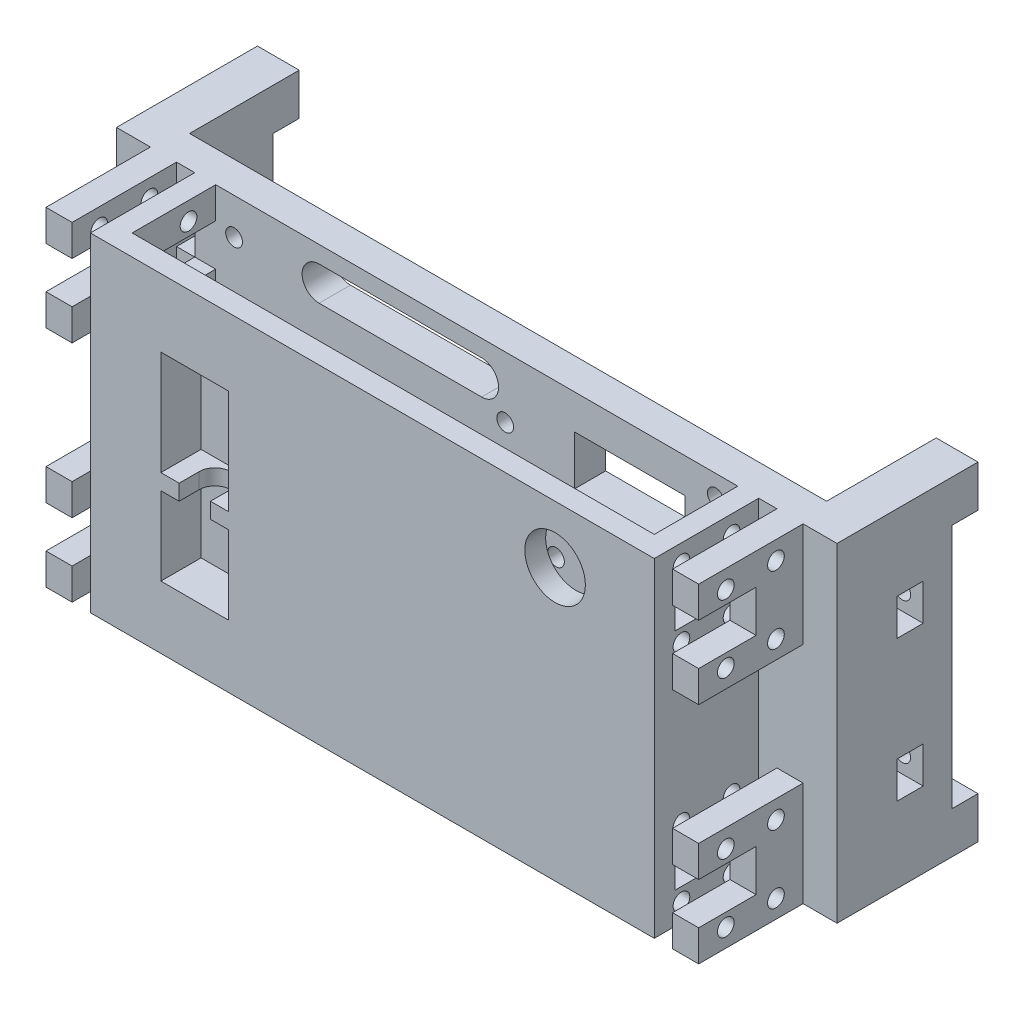
from build123d import *

# Parameters (mm, degrees)
ESBO_O1_W                 = 69
ESBO_O1_H                 = 31.5
RESSALTO_EXTRUS_O1_DEPTH  = 6
ESBO_O2_W                 = 5
ESBO_O2_H                 = 20
RESSALTO_EXTRUS_O2_DEPTH  = 20
ESBO_O3_W                 = 5
ESBO_O3_H                 = 8
CORTE_EXTRUS_O1_DEPTH     = 11
ESBO_O4_W                 = 4
ESBO_O4_H                 = 31.5
RESSALTO_EXTRUS_O3_DEPTH  = 20
ESBO_O5_W                 = 16
ESBO_O5_H                 = 8
CORTE_EXTRUS_O2_DEPTH     = 4
ESBO_O31_W                = 3.5
ESBO_O31_H                = 8
CORTE_EXTRUS_O14_DEPTH    = 6
CORTE_EXTRUS_O19_START    = -12.5
ESBO_O38_R                = 1.6
CORTE_EXTRUS_O19_DEPTH    = 12.5
ESBO_O6_W                 = 4
ESBO_O6_H                 = 31.5
RESSALTO_EXTRUS_O4_DEPTH  = 50
ESBO_O18_R                = 3.8
CORTE_EXTRUS_O3_DEPTH     = 4
CORTE_EXTRUS_O5_REACH     = 82.254
ESBO_O19_R                = 5.8
ESBO_O20_W                = 20
ESBO_O20_H                = 45
RESSALTO_EXTRUS_O9_DEPTH  = 7
ESBO_O21_W                = 13
ESBO_O21_H                = 15
CORTE_EXTRUS_O6_DEPTH     = 7.7
ESBO_O22_W                = 13
ESBO_O22_H                = 20
CORTE_EXTRUS_O7_DEPTH     = 7.7
CORTE_EXTRUS_O9_DEPTH     = 3
ESBO_O24_W                = 8
ESBO_O24_H                = 63
RESSALTO_EXTRUS_O10_DEPTH = 16
ESBO_O25_W                = 8
ESBO_O25_H                = 63
RESSALTO_EXTRUS_O11_DEPTH = 16
ESBO_O27_W                = 12.7
ESBO_O27_H                = 12.4
CORTE_EXTRUS_O10_DEPTH    = 137.307548116
ESBO_O28_R                = 1.6
CORTE_EXTRUS_O11_DEPTH    = 6
ESBO_O29_W                = 44.435411128
ESBO_O29_H                = 26.703816497
CORTE_EXTRUS_O12_DEPTH    = 6
ESBO_O30_W                = 21.186577755
ESBO_O30_H                = 9.500403815
CORTE_EXTRUS_O13_DEPTH    = 6
ESBO_O32_W                = 8
ESBO_O32_H                = 8
RESSALTO_EXTRUS_O12_DEPTH = 5
ESBO_O34_W                = 5
ESBO_O34_H                = 7
CORTE_EXTRUS_O15_DEPTH    = 8
ESBO_O35_R                = 1.6
ESBO_O35_R_2              = 1.586924898
CORTE_EXTRUS_O16_DEPTH    = 5.5
ESBO_O36_W                = 5
ESBO_O36_H                = 7
CORTE_EXTRUS_O17_DEPTH    = 8
ESBO_O37_R                = 1.6
CORTE_EXTRUS_O18_DEPTH    = 10.5


with BuildPart() as part:
    # Esboço1 → Ressalto-extrusão1 (new body)
    with BuildSketch(Plane.XY):
        with Locations((-34.5, -15.931977108)):
            Rectangle(ESBO_O1_W, ESBO_O1_H)
    extrude(amount=RESSALTO_EXTRUS_O1_DEPTH)

    # Esboço2 → Ressalto-extrusão2 (add)
    with BuildSketch(Plane.XY.offset(6)):
        with Locations((-60, -21.681977108)):
            Rectangle(ESBO_O2_W, ESBO_O2_H)
    extrude(amount=RESSALTO_EXTRUS_O2_DEPTH)

    # Esboço3 → Corte-extrusão1 (cut)
    with BuildSketch(Plane.XY.offset(26)):
        with Locations((-60, -21.681977108)):
            Rectangle(ESBO_O3_W, ESBO_O3_H)
    extrude(amount=-CORTE_EXTRUS_O1_DEPTH, mode=Mode.SUBTRACT)

    # Esboço4 → Ressalto-extrusão3 (add)
    with BuildSketch(Plane.XY.offset(6)):
        with Locations((-52, -15.931977108)):
            Rectangle(ESBO_O4_W, ESBO_O4_H)
    extrude(amount=RESSALTO_EXTRUS_O3_DEPTH)

    # Esboço5 → Corte-extrusão2 (cut)
    with BuildSketch(Plane(origin=(-50, 0, 0), x_dir=(0, 0, -1), z_dir=(1, 0, 0))):
        with Locations((-14, -21.681977108)):
            Rectangle(ESBO_O5_W, ESBO_O5_H)
    extrude(amount=-CORTE_EXTRUS_O2_DEPTH, mode=Mode.SUBTRACT)

    # Esboço31 → Corte-extrusão14 (cut)
    with BuildSketch(Plane.XY.offset(6)):
        with Locations((-55.75, -21.681977108)):
            Rectangle(ESBO_O31_W, ESBO_O31_H)
    extrude(amount=-CORTE_EXTRUS_O14_DEPTH, mode=Mode.SUBTRACT)

    # Esboço38 → Corte-extrusão19 (cut)
    with BuildSketch(Plane.ZY.offset(62.5).offset(CORTE_EXTRUS_O19_START)):
        with Locations((11.2, -15.181977108)):
            Circle(ESBO_O38_R)
        with Locations((20.8, -15.181977108)):
            Circle(ESBO_O38_R)
        with Locations((20.8, -28.181977108)):
            Circle(ESBO_O38_R)
        with Locations((11.2, -28.181977108)):
            Circle(ESBO_O38_R)
    extrude(amount=CORTE_EXTRUS_O19_DEPTH, mode=Mode.SUBTRACT)

    # Esboço6 → Ressalto-extrusão4 (add)
    with BuildSketch(Plane(origin=(-50, 0, 0), x_dir=(0, 0, -1), z_dir=(1, 0, 0))):
        with Locations((-24, -15.931977108)):
            Rectangle(ESBO_O6_W, ESBO_O6_H)
    extrude(amount=RESSALTO_EXTRUS_O4_DEPTH)

    # Espelhar10: part across plane


with BuildPart() as part_1:
    add(part.part)
    add(part.part.mirror(Plane.ZX.offset(-0.181977108)))

    # Espelhar11: part across plane


with BuildPart() as part_2:
    add(part_1.part)
    add(part_1.part.mirror(Plane(origin=(0, 0, 0), x_dir=(0, 0, 1), z_dir=(1, 0, 0))))

    # Esboço18 → Corte-extrusão3 (cut)
    with BuildSketch(Plane.ZY.offset(54)):
        with Locations((16, -0.181977108)):
            Circle(ESBO_O18_R)
    extrude(amount=-CORTE_EXTRUS_O3_DEPTH, mode=Mode.SUBTRACT)

    # Esboço19 → Corte-extrusão5 (cut, up to next)
    with BuildSketch(Plane.XY.offset(26), mode=Mode.PRIVATE) as corte_extrus_o5_sk1:
        with Locations((35, 20.318022892)):
            Circle(ESBO_O19_R)
    corte_extrus_o5_tool1 = extrude(corte_extrus_o5_sk1.sketch, amount=-CORTE_EXTRUS_O5_REACH, mode=Mode.PRIVATE) & part_2.part
    add(corte_extrus_o5_tool1.solids().sort_by_distance((35, 20.318023, 26))[0], mode=Mode.SUBTRACT)

    # Esboço20 → Ressalto-extrusão9 (add)
    with BuildSketch(Plane(origin=(0, 0, 22), x_dir=(-1, 0, 0), z_dir=(0, 0, -1))):
        with Locations((34, -0.181977108)):
            Rectangle(ESBO_O20_W, ESBO_O20_H)
    extrude(amount=RESSALTO_EXTRUS_O9_DEPTH)

    # Esboço21 → Corte-extrusão6 (cut)
    with BuildSketch(Plane.XY.offset(26)):
        with Locations((-34, -12.181977108)):
            Rectangle(ESBO_O21_W, ESBO_O21_H)
    extrude(amount=-CORTE_EXTRUS_O6_DEPTH, mode=Mode.SUBTRACT)

    # Esboço22 → Corte-extrusão7 (cut)
    with BuildSketch(Plane.XY.offset(26)):
        with Locations((-34, 8.318022892)):
            Rectangle(ESBO_O22_W, ESBO_O22_H)
    extrude(amount=-CORTE_EXTRUS_O7_DEPTH, mode=Mode.SUBTRACT)

    # Esboço23 → Corte-extrusão9 (cut)
    with BuildSketch(Plane(origin=(0, -1.681977108, 0), x_dir=(1, 0, 0), z_dir=(0, 1, 0))):
        with BuildLine():
            Line((-31, -26), (-31, -22.15))
            ThreePointArc((-31, -22.15), (-34, -19.15), (-37, -22.15))
            Line((-37, -22.15), (-37, -26))
            Line((-37, -26), (-31, -26))
        make_face()
    extrude(amount=-CORTE_EXTRUS_O9_DEPTH, mode=Mode.SUBTRACT)

    # Esboço24 → Ressalto-extrusão10 (add)
    with BuildSketch(Plane(origin=(0, 0, 0), x_dir=(-1, 0, 0), z_dir=(0, 0, -1))):
        with Locations((65, -0.181977108)):
            Rectangle(ESBO_O24_W, ESBO_O24_H)
    extrude(amount=RESSALTO_EXTRUS_O10_DEPTH)

    # Esboço25 → Ressalto-extrusão11 (add)
    with BuildSketch(Plane(origin=(0, 0, 0), x_dir=(-1, 0, 0), z_dir=(0, 0, -1))):
        with Locations((-65, -0.181977108)):
            Rectangle(ESBO_O25_W, ESBO_O25_H)
    extrude(amount=RESSALTO_EXTRUS_O11_DEPTH)

    # Esboço27 → Corte-extrusão10 (cut, through all)
    with BuildSketch(Plane(origin=(-61, 0, 0), x_dir=(0, 0, -1), z_dir=(1, 0, 0))):
        with Locations((6.35, -10.681977108)):
            Rectangle(ESBO_O27_W, ESBO_O27_H)
    extrude(amount=-CORTE_EXTRUS_O10_DEPTH, mode=Mode.SUBTRACT)

    # Esboço28 → Corte-extrusão11 (cut)
    with BuildSketch(Plane(origin=(0, 0, 0), x_dir=(-1, 0, 0), z_dir=(0, 0, -1))):
        with Locations((46.48315, 24.356572892)):
            Circle(ESBO_O28_R)
        with Locations((-5.44715, 19.606772892)):
            Circle(ESBO_O28_R)
        with Locations((-5.44715, -8.320527108)):
            Circle(ESBO_O28_R)
        with Locations((45.34015, -23.560527108)):
            Circle(ESBO_O28_R)
        with Locations((-15.175, -16.506977108)):
            Circle(ESBO_O28_R)
        with Locations((-15.175, 2.143022892)):
            Circle(ESBO_O28_R)
        with Locations((-15.5824, 11.068022892)):
            Circle(ESBO_O28_R)
        with Locations((-45.7824, 27.318022892)):
            Circle(ESBO_O28_R)
        with Locations((-42.5, 5.518022892)):
            Circle(ESBO_O28_R)
        with Locations((-26.25, -24.681977108)):
            Circle(ESBO_O28_R)
    extrude(amount=-CORTE_EXTRUS_O11_DEPTH, mode=Mode.SUBTRACT)

    # Esboço29 → Corte-extrusão12 (cut)
    with BuildSketch(Plane(origin=(0, 0, 0), x_dir=(-1, 0, 0), z_dir=(0, 0, -1))):
        with BuildLine():
            Line((36.950347595, -27.681977108), (-15.700330727, -27.681977108))
            ThreePointArc((-15.700330727, -27.681977108), (-18.950330727, -24.431977108), (-15.700330727, -21.181977108))
            Line((-15.700330727, -21.181977108), (36.950347595, -21.181977108))
            ThreePointArc((36.950347595, -21.181977108), (40.200347595, -24.431977108), (36.950347595, -27.681977108))
        make_face()
        with BuildLine():
            Line((30.19871411, 21.568022892), (-0.931643445, 21.568022892))
            ThreePointArc((-0.931643445, 21.568022892), (-4.181643445, 24.818022892), (-0.931643445, 28.068022892))
            Line((-0.931643445, 28.068022892), (30.19871411, 28.068022892))
            ThreePointArc((30.19871411, 28.068022892), (33.44871411, 24.818022892), (30.19871411, 21.568022892))
        make_face()
        with Locations((22.217705564, 0.936939366)):
            Rectangle(ESBO_O29_W, ESBO_O29_H)
    extrude(amount=-CORTE_EXTRUS_O12_DEPTH, mode=Mode.SUBTRACT)

    # Esboço30 → Corte-extrusão13 (cut)
    with BuildSketch(Plane(origin=(0, 0, 0), x_dir=(-1, 0, 0), z_dir=(0, 0, -1))):
        Polygon((-14.785612966, -2.659846733), (-14.785612966, -12.742724961), (-20.847075008, -12.742724961), (-20.847075008, -12.709632574), (-43.531451523, -12.709632574), (-43.531451523, -2.659846733), (-22.572999127, -2.659846733), align=None)
        with Locations((-29.272594924, 19.934169614)):
            Rectangle(ESBO_O30_W, ESBO_O30_H)
    extrude(amount=-CORTE_EXTRUS_O13_DEPTH, mode=Mode.SUBTRACT)

    # Esboço32 → Ressalto-extrusão12 (add)
    with BuildSketch(Plane(origin=(0, 0, -16), x_dir=(-1, 0, 0), z_dir=(0, 0, -1))):
        with Locations((65, 27.318022892)):
            Rectangle(ESBO_O32_W, ESBO_O32_H)
        with Locations((-65, -27.681977108)):
            Rectangle(ESBO_O32_W, ESBO_O32_H)
        with Locations((-65, 27.318022892)):
            Rectangle(ESBO_O32_W, ESBO_O32_H)
        with Locations((65, -27.681977108)):
            Rectangle(ESBO_O32_W, ESBO_O32_H)
    extrude(amount=RESSALTO_EXTRUS_O12_DEPTH)

    # Esboço34 → Corte-extrusão15 (cut)
    with BuildSketch(Plane.ZY.offset(-61)):
        with Locations((-8, -13.681977108)):
            Rectangle(ESBO_O34_W, ESBO_O34_H)
        with Locations((-8, 13.318022892)):
            Rectangle(ESBO_O34_W, ESBO_O34_H)
    extrude(amount=-CORTE_EXTRUS_O15_DEPTH, mode=Mode.SUBTRACT)

    # Esboço35 → Corte-extrusão16 (cut)
    with BuildSketch(Plane(origin=(0, 0, -16), x_dir=(-1, 0, 0), z_dir=(0, 0, -1))):
        with Locations((-65, 13.317230682)):
            Circle(ESBO_O35_R)
        with Locations((-65, -13.684353737)):
            Circle(ESBO_O35_R_2)
    extrude(amount=-CORTE_EXTRUS_O16_DEPTH, mode=Mode.SUBTRACT)

    # Esboço36 → Corte-extrusão17 (cut)
    with BuildSketch(Plane(origin=(-61, 0, 0), x_dir=(0, 0, -1), z_dir=(1, 0, 0))):
        with Locations((8, 9.418022892)):
            Rectangle(ESBO_O36_W, ESBO_O36_H)
    extrude(amount=-CORTE_EXTRUS_O17_DEPTH, mode=Mode.SUBTRACT)

    # Esboço37 → Corte-extrusão18 (cut)
    with BuildSketch(Plane(origin=(0, 0, -16), x_dir=(-1, 0, 0), z_dir=(0, 0, -1))):
        with Locations((65, 9.418022892)):
            Circle(ESBO_O37_R)
    extrude(amount=-CORTE_EXTRUS_O18_DEPTH, mode=Mode.SUBTRACT)


solid = part_2.part
